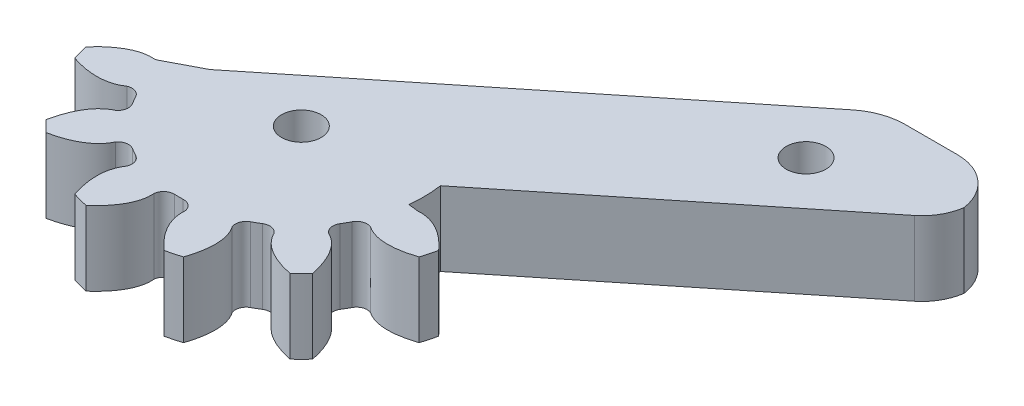
from build123d import *

# Parameters (mm, degrees)
ESBO_O1_R                = 1.6
RESSALTO_EXTRUS_O1_DEPTH = 6


with BuildPart() as part:
    # Esboço1 → Ressalto-extrusão1 (new body)
    with BuildSketch(Plane.XZ.offset(6)):
        with BuildLine():
            Line((24.26036734, -24.5), (28.5, -24.5))
            ThreePointArc((28.5, -24.5), (31.122071197, -23.520718894), (32.460270003, -21.062371319))
            ThreePointArc((32.460270003, -21.062371319), (31.976417823, -19.646228266), (31.005959689, -18.507024557))
            Line((31.005959689, -18.507024557), (9.788591406, -1.452926582))
            ThreePointArc((9.788591406, -1.452926582), (9.894598333, -0.1563368), (9.829606895, 1.142954792))
            Line((9.829606895, 1.142954792), (10.623194285, 1.235230559))
            ThreePointArc((10.623194285, 1.235230559), (10.637816884, 1.237287137), (10.652472585, 1.239092776))
            add(Edge.make_bspline(
                [(10.652472585, 1.239092776), (12.4185109, 1.078975114), (14.239640851, 3.147417918)],
                knots=[0.078549619, 0.078549619, 0.078549619, 0.770539159, 0.770539159, 0.770539159], degree=2, weights=[1, 0.940738559, 1]))
            ThreePointArc((14.239640851, 3.147417918), (14.0864183, 3.774444408), (13.905599677, 4.394076552))
            add(Edge.make_bspline(
                [(13.905599677, 4.394076552), (11.294233474, 5.274835591), (9.84485826, 4.253150471)],
                knots=[5.512646149, 5.512646149, 5.512646149, 6.204635688, 6.204635688, 6.204635688], degree=2, weights=[1, 0.940738559, 1]))
            ThreePointArc((9.84485826, 4.253150471), (9.217248741, 4.230244905), (8.740864349, 4.639483569))
            ThreePointArc((8.740864349, 4.639483569), (8.570043058, 4.947916667), (8.388342806, 5.250068793))
            ThreePointArc((8.388342806, 5.250068793), (8.272123923, 5.86724911), (8.605765484, 6.399322114))
            add(Edge.make_bspline(
                [(8.605765484, 6.399322114), (10.21525836, 7.143675309), (10.758181759, 9.845564299)],
                knots=[0.078549619, 0.078549619, 0.078549619, 0.770539159, 0.770539159, 0.770539159], degree=2, weights=[1, 0.940738559, 1]))
            ThreePointArc((10.758181759, 9.845564299), (10.311973892, 10.311973892), (9.845564299, 10.758181759))
            add(Edge.make_bspline(
                [(9.845564299, 10.758181759), (7.143675309, 10.21525836), (6.399322114, 8.605765484)],
                knots=[2.371053495, 2.371053495, 2.371053495, 3.063043035, 3.063043035, 3.063043035], degree=2, weights=[1, 0.940738559, 1]))
            ThreePointArc((6.399322114, 8.605765484), (5.86724911, 8.272123923), (5.250068793, 8.388342806))
            ThreePointArc((5.250068793, 8.388342806), (4.947916667, 8.570043058), (4.639483569, 8.740864349))
            ThreePointArc((4.639483569, 8.740864349), (4.230244905, 9.217248741), (4.253150471, 9.84485826))
            add(Edge.make_bspline(
                [(4.253150471, 9.84485826), (5.274835591, 11.294233474), (4.394076552, 13.905599677)],
                knots=[0.078549619, 0.078549619, 0.078549619, 0.770539159, 0.770539159, 0.770539159], degree=2, weights=[1, 0.940738559, 1]))
            ThreePointArc((4.394076552, 13.905599677), (3.774444408, 14.0864183), (3.147417918, 14.239640851))
            add(Edge.make_bspline(
                [(3.147417918, 14.239640851), (1.078975114, 12.4185109), (1.239092776, 10.652472585)],
                knots=[2.371053495, 2.371053495, 2.371053495, 3.063043035, 3.063043035, 3.063043035], degree=2, weights=[1, 0.940738559, 1]))
            ThreePointArc((1.239092776, 10.652472585), (0.945124819, 10.097494016), (0.352521544, 9.889552362))
            ThreePointArc((0.352521544, 9.889552362), (0, 9.895833333), (-0.352521544, 9.889552362))
            ThreePointArc((-0.352521544, 9.889552362), (-0.945124819, 10.097494016), (-1.239092776, 10.652472585))
            add(Edge.make_bspline(
                [(-1.239092776, 10.652472585), (-1.078975114, 12.4185109), (-3.147417918, 14.239640851)],
                knots=[0.078549619, 0.078549619, 0.078549619, 0.770539159, 0.770539159, 0.770539159], degree=2, weights=[1, 0.940738559, 1]))
            ThreePointArc((-3.147417918, 14.239640851), (-3.774444408, 14.0864183), (-4.394076552, 13.905599677))
            add(Edge.make_bspline(
                [(-4.394076552, 13.905599677), (-5.274835591, 11.294233474), (-4.253150471, 9.84485826)],
                knots=[2.371053495, 2.371053495, 2.371053495, 3.063043035, 3.063043035, 3.063043035], degree=2, weights=[1, 0.940738559, 1]))
            ThreePointArc((-4.253150471, 9.84485826), (-4.230244905, 9.217248741), (-4.639483569, 8.740864349))
            ThreePointArc((-4.639483569, 8.740864349), (-4.947916667, 8.570043058), (-5.250068793, 8.388342806))
            ThreePointArc((-5.250068793, 8.388342806), (-5.86724911, 8.272123923), (-6.399322114, 8.605765484))
            add(Edge.make_bspline(
                [(-6.399322114, 8.605765484), (-7.143675309, 10.21525836), (-9.845564299, 10.758181759)],
                knots=[0.078549619, 0.078549619, 0.078549619, 0.770539159, 0.770539159, 0.770539159], degree=2, weights=[1, 0.940738559, 1]))
            ThreePointArc((-9.845564299, 10.758181759), (-10.311973892, 10.311973892), (-10.758181759, 9.845564299))
            add(Edge.make_bspline(
                [(-10.758181759, 9.845564299), (-10.21525836, 7.143675309), (-8.605765484, 6.399322114)],
                knots=[2.371053495, 2.371053495, 2.371053495, 3.063043035, 3.063043035, 3.063043035], degree=2, weights=[1, 0.940738559, 1]))
            ThreePointArc((-8.605765484, 6.399322114), (-8.272123923, 5.86724911), (-8.388342806, 5.250068793))
            ThreePointArc((-8.388342806, 5.250068793), (-8.570043058, 4.947916667), (-8.740864349, 4.639483569))
            ThreePointArc((-8.740864349, 4.639483569), (-9.217248741, 4.230244905), (-9.84485826, 4.253150471))
            add(Edge.make_bspline(
                [(-9.84485826, 4.253150471), (-11.294233474, 5.274835591), (-13.905599677, 4.394076552)],
                knots=[3.220142273, 3.220142273, 3.220142273, 3.912131812, 3.912131812, 3.912131812], degree=2, weights=[1, 0.940738559, 1]))
            ThreePointArc((-13.905599677, 4.394076552), (-14.0864183, 3.774444408), (-14.239640851, 3.147417918))
            add(Edge.make_bspline(
                [(-14.239640851, 3.147417918), (-12.4185109, 1.078975114), (-10.652472585, 1.239092776)],
                knots=[2.371053495, 2.371053495, 2.371053495, 3.063043035, 3.063043035, 3.063043035], degree=2, weights=[1, 0.940738559, 1]))
            ThreePointArc((-10.652472585, 1.239092776), (-10.557951639, 1.222896434), (-10.465816504, 1.196294788))
            ThreePointArc((-10.465816504, 1.196294788), (-10.466260875, 1.201681391), (-10.466707243, 1.207067829))
            Line((-10.466707243, 1.207067829), (-7.642065772, -0.272407964))
            Line((-7.642065772, -0.272407964), (21.127917729, -23.397147602))
            ThreePointArc((21.127917729, -23.397147602), (22.599906261, -24.216234622), (24.26036734, -24.5))
        make_face()
        with Locations(Location((0, 0, 0), (0, 0, 90))):
            Circle(ESBO_O1_R, mode=Mode.SUBTRACT)
        with Locations(Location((22.598401843, -18.16414524, 0), (0, 0, 90))):
            Circle(ESBO_O1_R, mode=Mode.SUBTRACT)
    extrude(amount=-RESSALTO_EXTRUS_O1_DEPTH)


solid = part.part
